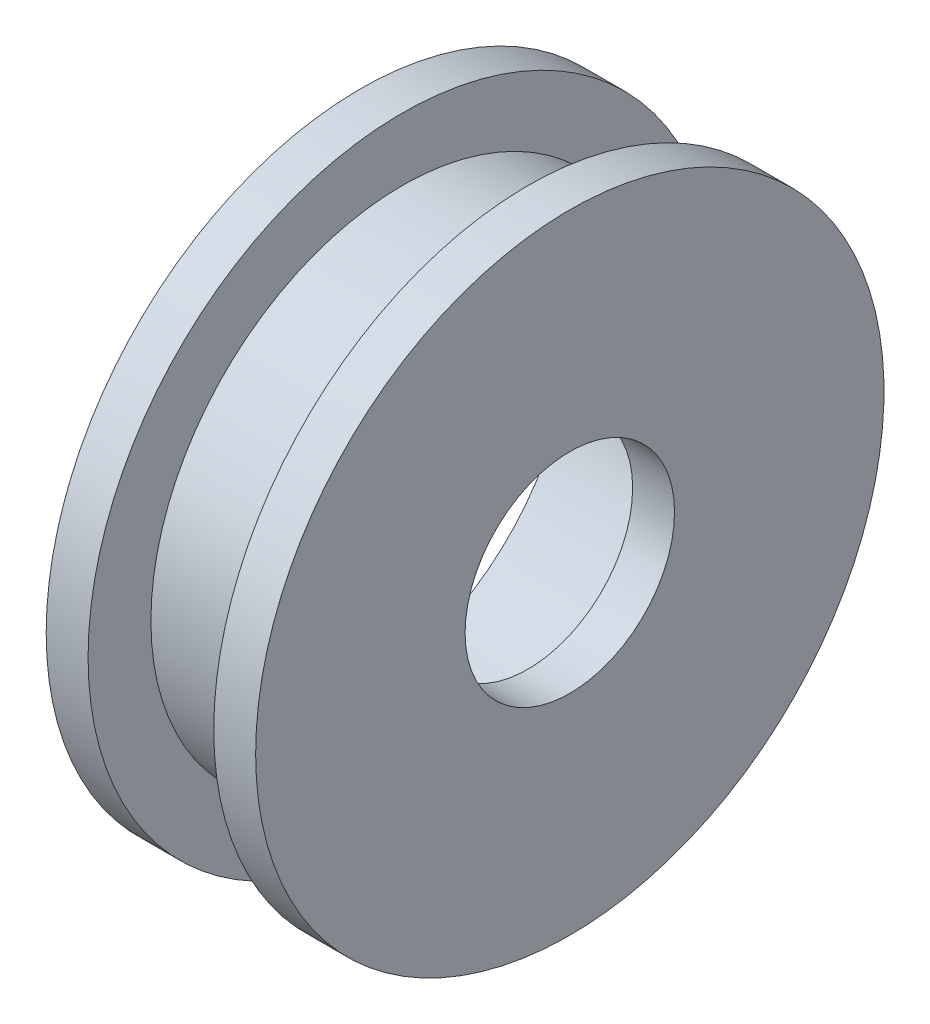
from build123d import *


with BuildPart() as part:
    # Esquisse1 → Révolution1 (revolve)
    with BuildSketch(Plane.XY, mode=Mode.PRIVATE) as r_volution1_sk:
        Polygon((-4, -7.5), (-4, -6), (-1, -6), (-1, -7.5), (0, -7.5), (0, -2.5), (-1, -2.5), (-1, -5), (-5, -5), (-5, -7.5), align=None)
    revolve(r_volution1_sk.sketch.rotate(Axis((0, 0, 0), (1, 0, 0)), 270), axis=Axis((0, 0, 0), (1, 0, 0)))


solid = part.part
